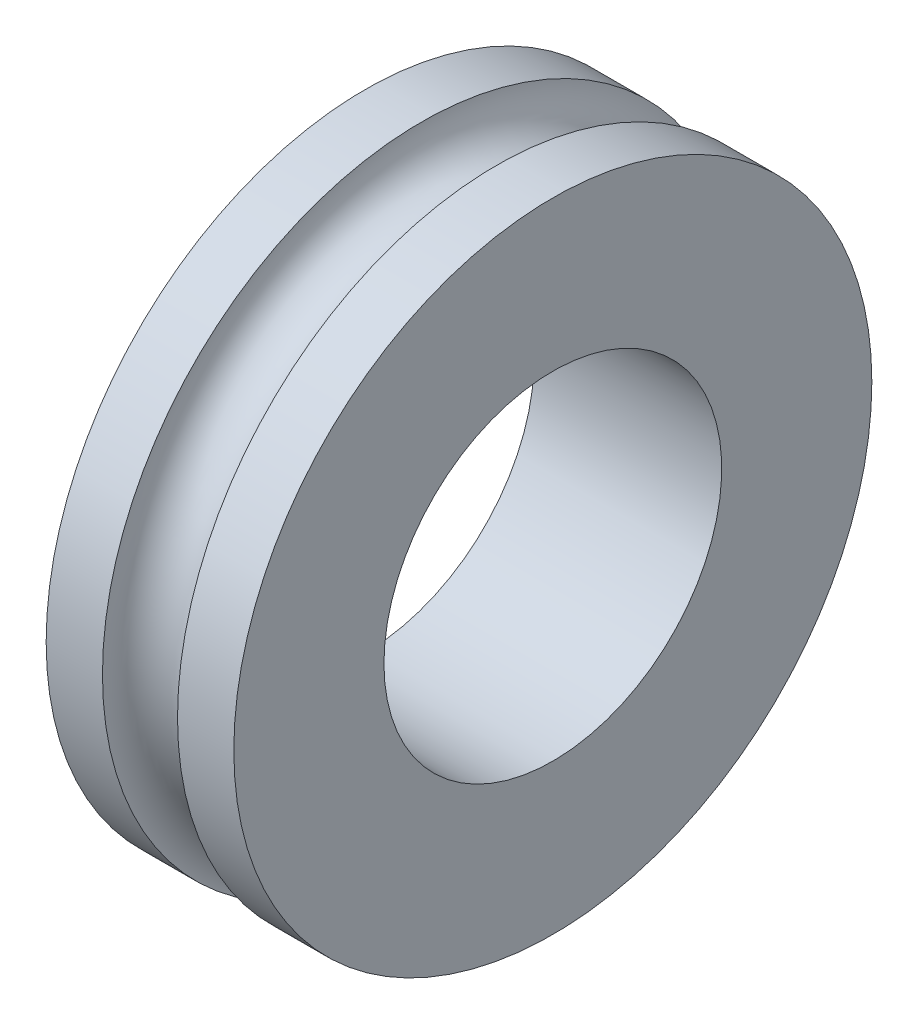
from build123d import *


with BuildPart() as part:
    # 草图1 → 旋转1 (revolve)
    with BuildSketch(Plane.XY, mode=Mode.PRIVATE) as revolve_1_sk:
        with BuildLine():
            Line((1, 8.5), (2.5, 8.5))
            Line((2.5, 8.5), (2.5, 4.5))
            Line((2.5, 4.5), (-2.5, 4.5))
            Line((-2.5, 4.5), (-2.5, 8.5))
            Line((-2.5, 8.5), (-1, 8.5))
            ThreePointArc((-1, 8.5), (0, 7.5), (1, 8.5))
        make_face()
    revolve(revolve_1_sk.sketch.rotate(Axis((0, 0, 0), (1, 0, 0)), 90), axis=Axis((0, 0, 0), (1, 0, 0)))


solid = part.part
